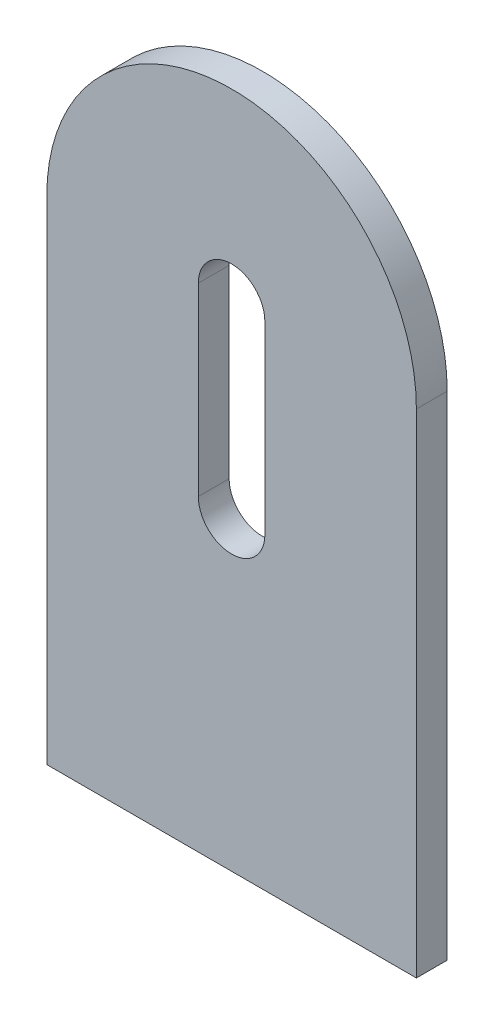
from build123d import *

# Parameters (mm, degrees)
BOSS_EXTRUDE1_DEPTH = 3.175


with BuildPart() as part:
    # Sketch1 → Boss-Extrude1 (new body)
    with BuildSketch(Plane.XY):
        with BuildLine():
            Line((0, 0), (38.1, 0))
            Line((38.1, 0), (38.1, 50.8))
            ThreePointArc((38.1, 50.8), (19.05, 69.85), (0, 50.8))
            Line((0, 50.8), (0, 0))
        make_face()
        with BuildLine():
            Line((15.621, 50.8), (15.621, 31.75))
            ThreePointArc((15.621, 31.75), (19.05, 28.321), (22.479, 31.75))
            Line((22.479, 31.75), (22.479, 50.8))
            ThreePointArc((22.479, 50.8), (19.05, 54.229), (15.621, 50.8))
        make_face(mode=Mode.SUBTRACT)
    extrude(amount=BOSS_EXTRUDE1_DEPTH)


solid = part.part
